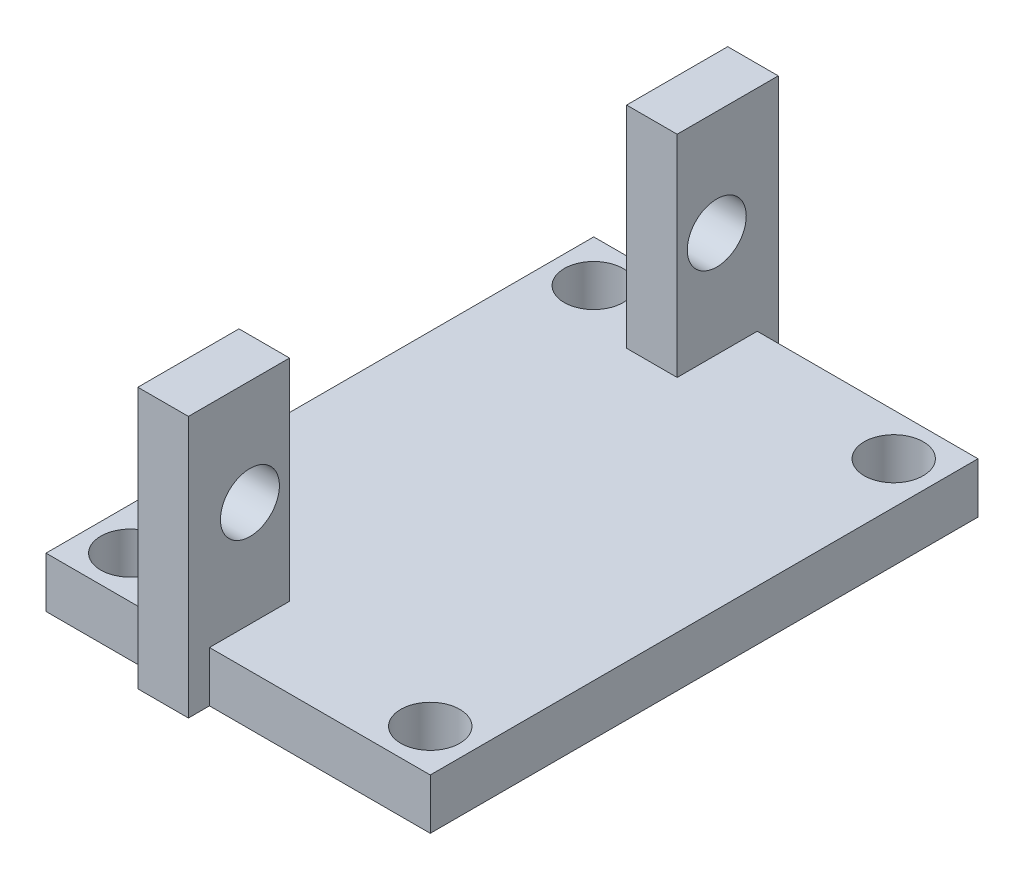
from build123d import *

# Parameters (mm, degrees)
SKETCH_1_W          = 22.8
SKETCH_1_H          = 32.5
EXTRUDE_1_DEPTH     = 3
SKETCH_4_R          = 1.75
CUT_EXTRUDE_2_DEPTH = 10
EXTRUDE_START       = -3
SKETCH_2_W          = 3
SKETCH_2_H          = 6
EXTRUDE_2_DEPTH     = 15.5
SKETCH_3_R          = 1.75
CUT_EXTRUDE_1_DEPTH = 27.797574517


with BuildPart() as part:
    # 草图1 → 凸台-拉伸1 (new body)
    with BuildSketch(Plane(origin=(0, 0, 0), x_dir=(1, 0, 0), z_dir=(0, 1, 0))):
        Rectangle(SKETCH_1_W, SKETCH_1_H)
    extrude(amount=EXTRUDE_1_DEPTH)

    # 草图4 → 切除-拉伸2 (cut)
    with BuildSketch(Plane(origin=(0, 3, 0), x_dir=(1, 0, 0), z_dir=(0, 1, 0))):
        with Locations(Location((-8.9, 13.75, 0), (0, 0, 270))):
            Circle(SKETCH_4_R)
        with Locations(Location((8.9, 13.75, 0), (0, 0, 270))):
            Circle(SKETCH_4_R)
        with Locations(Location((-8.9, -13.75, 0), (0, 0, 270))):
            Circle(SKETCH_4_R)
        with Locations(Location((8.9, -13.75, 0), (0, 0, 270))):
            Circle(SKETCH_4_R)
    extrude(amount=-CUT_EXTRUDE_2_DEPTH, mode=Mode.SUBTRACT)

    # 草图2 → 凸台-拉伸2 (add)
    with BuildSketch(Plane(origin=(0, 3, 0), x_dir=(1, 0, 0), z_dir=(0, 1, 0)).offset(EXTRUDE_START)):
        with Locations((-3.2, -14.5)):
            Rectangle(SKETCH_2_W, SKETCH_2_H)
        with Locations((-3.2, 14.5)):
            Rectangle(SKETCH_2_W, SKETCH_2_H)
    extrude(amount=EXTRUDE_2_DEPTH)

    # 草图3 → 切除-拉伸1 (cut, through all)
    with BuildSketch(Plane(origin=(-1.7, 0, 0), x_dir=(0, 0, -1), z_dir=(1, 0, 0))):
        with Locations((-13.85, 9.25)):
            Circle(SKETCH_3_R)
        with Locations((13.85, 9.25)):
            Circle(SKETCH_3_R)
    extrude(amount=-CUT_EXTRUDE_1_DEPTH, mode=Mode.SUBTRACT)


solid = part.part
